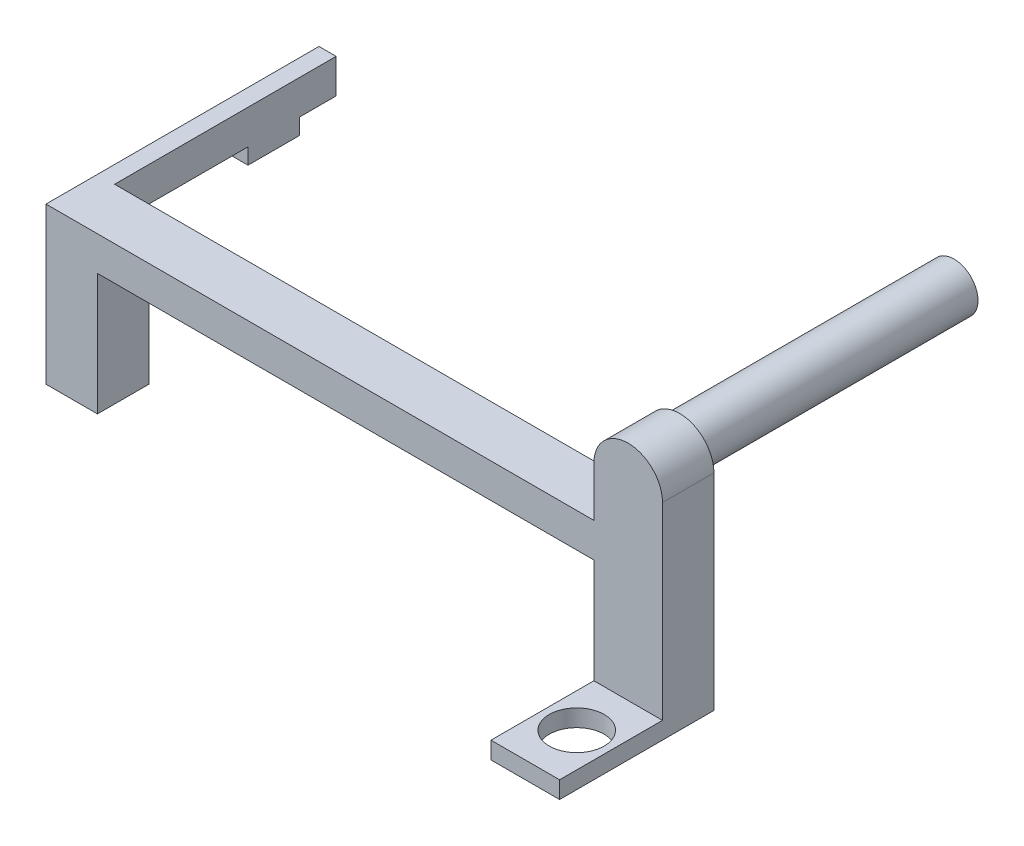
from build123d import *

# Parameters (mm, degrees)
SKETCH1_W            = 4
SKETCH1_H            = 14
BOSS_EXTRUDE1_DEPTH  = 3
SKETCH2_R            = 1.4
BOSS_EXTRUDE2_DEPTH  = 16
FILLET1_RADIUS       = 2
FILLET1_LENGTH       = 3
SKETCH3_W            = 4
SKETCH3_H            = 1
BOSS_EXTRUDE4_DEPTH  = 6
SKETCH6_R            = 1.6
CUT_EXTRUDE2_DEPTH   = 6
SKETCH7_W            = 3
SKETCH7_H            = 2
BOSS_EXTRUDE5_DEPTH  = 30.95
SKETCH8_W            = 3
SKETCH8_H            = 2
BOSS_EXTRUDE6_DEPTH  = 1
SKETCH9_W            = 1
SKETCH9_H            = 2
BOSS_EXTRUDE7_DEPTH  = 3
SKETCH10_W           = 1
SKETCH10_H           = 2
BOSS_EXTRUDE8_DEPTH  = 5.92
SKETCH11_W           = 1
SKETCH11_H           = 2
BOSS_EXTRUDE9_DEPTH  = 4
SKETCH12_W           = 1
SKETCH12_H           = 3
BOSS_EXTRUDE14_DEPTH = 0.93
SKETCH13_W           = 3
SKETCH13_H           = 3
BOSS_EXTRUDE15_DEPTH = 7.1


with BuildPart() as part:
    # Sketch1 → Boss-Extrude1 (new body)
    with BuildSketch(Plane.XY):
        with Locations((-1.434146341, -3.597560976)):
            Rectangle(SKETCH1_W, SKETCH1_H)
    extrude(amount=BOSS_EXTRUDE1_DEPTH)

    # Sketch2 → Boss-Extrude2 (add)
    with BuildSketch(Plane(origin=(0, 0, 0), x_dir=(-1, 0, 0), z_dir=(0, 0, -1))):
        with Locations(Location((1.434146341, 1.802439024, 0), (0, 0, 180))):
            Circle(SKETCH2_R)
    extrude(amount=BOSS_EXTRUDE2_DEPTH)

    # Fillet1: full round fillet: the end face becomes a half cylinder, R = half its width
    fillet1_face = Plane((-1.434146341, 3.402439024, 1.5), x_dir=(0, 0, 1), z_dir=(0, 1, 0))  # on the end face: x along it, z out of the body
    fillet1_slab = fillet1_face.offset(-FILLET1_RADIUS / 2) * Box(FILLET1_LENGTH, 2 * FILLET1_RADIUS, FILLET1_RADIUS, mode=Mode.PRIVATE)  # the body's end, R deep
    fillet1_round = Plane((-1.434146341, 1.402439024, 1.5), x_dir=(0, 1, 0), z_dir=(0, 0, 1)) * Cylinder(FILLET1_RADIUS, FILLET1_LENGTH, mode=Mode.PRIVATE)  # its axis R under the face
    add(fillet1_slab - fillet1_round, mode=Mode.SUBTRACT)

    # Sketch3 → Boss-Extrude4 (add)
    with BuildSketch(Plane.XY.offset(3)):
        with Locations((-1.434146341, -10.097560976)):
            Rectangle(SKETCH3_W, SKETCH3_H)
    extrude(amount=BOSS_EXTRUDE4_DEPTH)

    # Sketch6 → Cut-Extrude2 (cut)
    with BuildSketch(Plane(origin=(0, -9.597560976, 0), x_dir=(1, 0, 0), z_dir=(0, 1, 0))):
        with Locations(Location((-1.434146341, -6, 0), (0, 0, 270))):
            Circle(SKETCH6_R)
    extrude(amount=-CUT_EXTRUDE2_DEPTH, mode=Mode.SUBTRACT)

    # Sketch7 → Boss-Extrude5 (add)
    with BuildSketch(Plane.ZY.offset(3.434146341)):
        with Locations((1.5, -2.497560976)):
            Rectangle(SKETCH7_W, SKETCH7_H)
    extrude(amount=BOSS_EXTRUDE5_DEPTH)

    # Sketch8 → Boss-Extrude6 (add)
    with BuildSketch(Plane.ZY.offset(34.384146341)):
        with Locations((1.5, -2.497560976)):
            Rectangle(SKETCH8_W, SKETCH8_H)
    extrude(amount=BOSS_EXTRUDE6_DEPTH)

    # Sketch9 → Boss-Extrude7 (add)
    with BuildSketch(Plane(origin=(0, 0, 0), x_dir=(-1, 0, 0), z_dir=(0, 0, -1))):
        with Locations((34.884146341, -2.497560976)):
            Rectangle(SKETCH9_W, SKETCH9_H)
    extrude(amount=BOSS_EXTRUDE7_DEPTH)

    # Sketch10 → Boss-Extrude8 (add)
    with BuildSketch(Plane(origin=(0, 0, -3), x_dir=(-1, 0, 0), z_dir=(0, 0, -1))):
        with Locations((34.884146341, -2.497560976)):
            Rectangle(SKETCH10_W, SKETCH10_H)
    extrude(amount=BOSS_EXTRUDE8_DEPTH)

    # Sketch11 → Boss-Extrude9 (add)
    with BuildSketch(Plane(origin=(0, 0, -8.92), x_dir=(-1, 0, 0), z_dir=(0, 0, -1))):
        with Locations((34.884146341, -2.497560976)):
            Rectangle(SKETCH11_W, SKETCH11_H)
    extrude(amount=BOSS_EXTRUDE9_DEPTH)

    # Sketch12 → Boss-Extrude14 (add)
    with BuildSketch(Plane.XZ.offset(3.497560976)):
        with Locations((-34.884146341, -9.28)):
            Rectangle(SKETCH12_W, SKETCH12_H)
    extrude(amount=BOSS_EXTRUDE14_DEPTH)

    # Sketch13 → Boss-Extrude15 (add)
    with BuildSketch(Plane.XZ.offset(3.497560976)):
        with Locations((-33.884146341, 1.5)):
            Rectangle(SKETCH13_W, SKETCH13_H)
    extrude(amount=BOSS_EXTRUDE15_DEPTH)


solid = part.part
